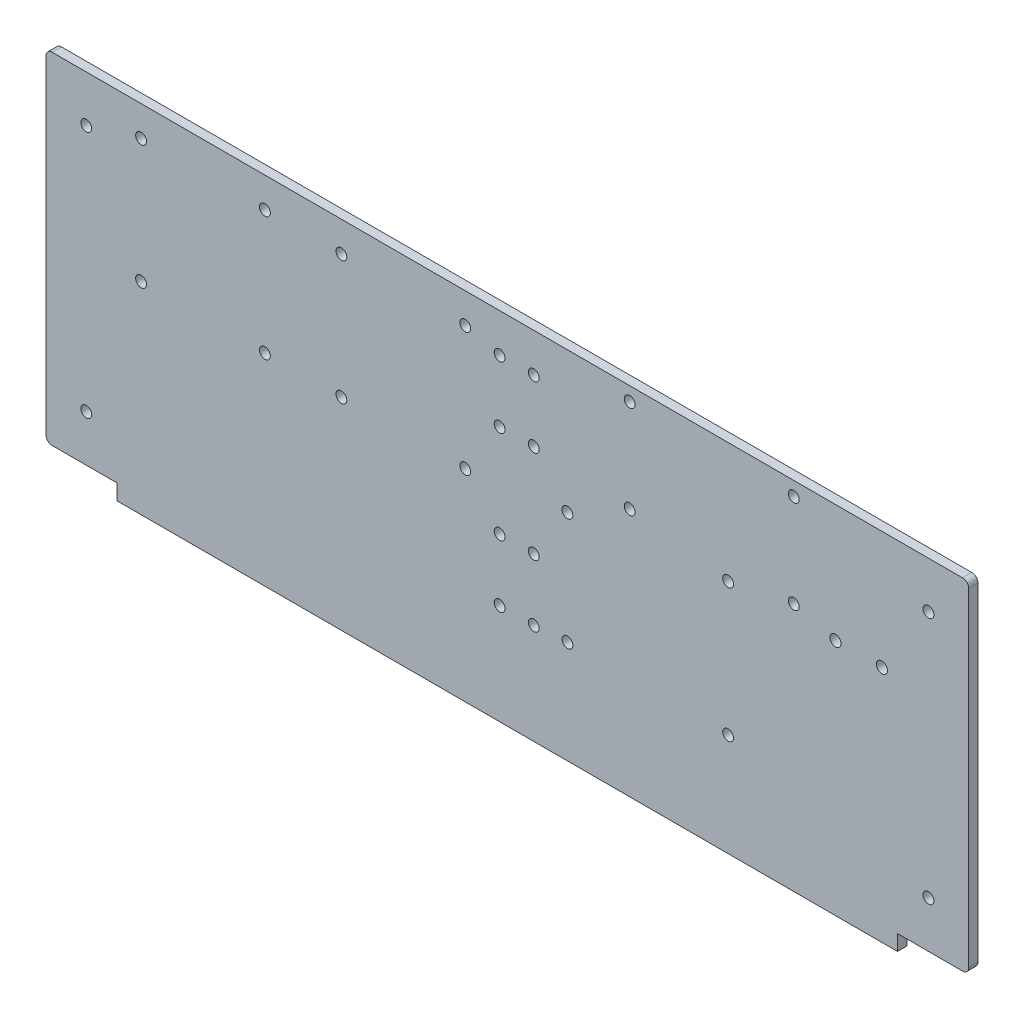
from build123d import *

# Parameters (mm, degrees)
SKETCH1_R           = 1.75
SKETCH1_R_2         = 1.8
BOSS_EXTRUDE1_DEPTH = 3


with BuildPart() as part:
    # Sketch1 → Boss-Extrude1 (new body)
    with BuildSketch(Plane.XY):
        with BuildLine():
            Line((126, 219), (126, 224))
            Line((126, 224), (147, 224))
            ThreePointArc((147, 224), (148.414213562, 224.585786438), (149, 226))
            Line((149, 226), (149, 332))
            ThreePointArc((149, 332), (148.414213562, 333.414213562), (147, 334))
            Line((147, 334), (-147, 334))
            ThreePointArc((-147, 334), (-148.414213562, 333.414213562), (-149, 332))
            Line((-149, 332), (-149, 226))
            ThreePointArc((-149, 226), (-148.414213562, 224.585786438), (-147, 224))
            Line((-147, 224), (-126, 224))
            Line((-126, 224), (-126, 219))
            Line((-126, 219), (-70, 219))
            Line((-70, 219), (70, 219))
            Line((70, 219), (126, 219))
        make_face()
        with Locations((136, 239)):
            Circle(SKETCH1_R, mode=Mode.SUBTRACT)
        with Locations((136, 319)):
            Circle(SKETCH1_R, mode=Mode.SUBTRACT)
        with Locations(Location((-136, 239, 0), (0, 0, 180))):
            Circle(SKETCH1_R, mode=Mode.SUBTRACT)
        with Locations(Location((-136, 319, 0), (0, 0, 180))):
            Circle(SKETCH1_R, mode=Mode.SUBTRACT)
        with Locations((-78.3, 324.25)):
            Circle(SKETCH1_R, mode=Mode.SUBTRACT)
        with Locations((-2.5, 321.5)):
            Circle(SKETCH1_R, mode=Mode.SUBTRACT)
        with Locations((-78.3, 284.25)):
            Circle(SKETCH1_R, mode=Mode.SUBTRACT)
        with Locations((-118.3, 324.25)):
            Circle(SKETCH1_R, mode=Mode.SUBTRACT)
        with Locations((-118.3, 284.25)):
            Circle(SKETCH1_R, mode=Mode.SUBTRACT)
        with Locations((-53.6, 324.25)):
            Circle(SKETCH1_R, mode=Mode.SUBTRACT)
        with Locations((-53.6, 284.25)):
            Circle(SKETCH1_R, mode=Mode.SUBTRACT)
        with Locations((-13.6, 324.25)):
            Circle(SKETCH1_R, mode=Mode.SUBTRACT)
        with Locations((-13.6, 284.25)):
            Circle(SKETCH1_R, mode=Mode.SUBTRACT)
        with Locations((71.3, 295.2)):
            Circle(SKETCH1_R, mode=Mode.SUBTRACT)
        with Locations((19.4, 288.5)):
            Circle(SKETCH1_R, mode=Mode.SUBTRACT)
        with Locations((19.4, 252.2)):
            Circle(SKETCH1_R, mode=Mode.SUBTRACT)
        with Locations((71.3, 252.2)):
            Circle(SKETCH1_R, mode=Mode.SUBTRACT)
        with Locations((39.5, 329.5)):
            Circle(SKETCH1_R, mode=Mode.SUBTRACT)
        with Locations((39.5, 299.5)):
            Circle(SKETCH1_R, mode=Mode.SUBTRACT)
        with Locations((92.5, 329.5)):
            Circle(SKETCH1_R, mode=Mode.SUBTRACT)
        with Locations((92.5, 299.5)):
            Circle(SKETCH1_R, mode=Mode.SUBTRACT)
        with Locations((8.54, 321.5)):
            Circle(SKETCH1_R, mode=Mode.SUBTRACT)
        with Locations((-2.5, 301.5)):
            Circle(SKETCH1_R, mode=Mode.SUBTRACT)
        with Locations((8.54, 301.5)):
            Circle(SKETCH1_R, mode=Mode.SUBTRACT)
        with Locations((-2.5, 271.5)):
            Circle(SKETCH1_R, mode=Mode.SUBTRACT)
        with Locations((8.54, 271.5)):
            Circle(SKETCH1_R, mode=Mode.SUBTRACT)
        with Locations((8.54, 251.5)):
            Circle(SKETCH1_R, mode=Mode.SUBTRACT)
        with Locations((-2.5, 251.5)):
            Circle(SKETCH1_R, mode=Mode.SUBTRACT)
        with Locations((105.977507251, 295.945086532)):
            Circle(SKETCH1_R_2, mode=Mode.SUBTRACT)
        with Locations((120.977507251, 295.945086532)):
            Circle(SKETCH1_R_2, mode=Mode.SUBTRACT)
    extrude(amount=BOSS_EXTRUDE1_DEPTH)


solid = part.part
